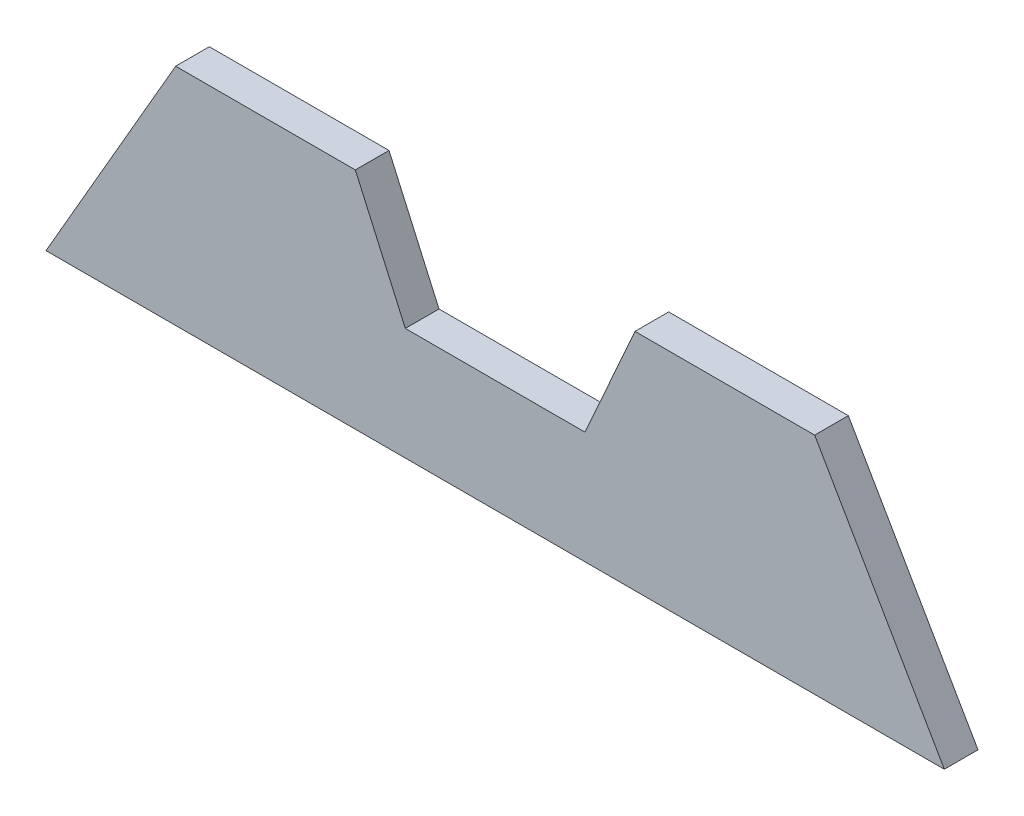
from build123d import *

# Parameters (mm, degrees)
BOSS_EXTRUDE1_DEPTH = 3


with BuildPart() as part:
    # Sketch2 → Boss-Extrude1 (new, symmetric)
    with BuildSketch(Plane.XY):
        Polygon((0, 0), (23.094010768, 40), (55.094010768, 40), (64, 20), (96, 20), (104.905989232, 40), (136.905989232, 40), (160, 0), align=None)
    extrude(amount=BOSS_EXTRUDE1_DEPTH, both=True)


solid = part.part
